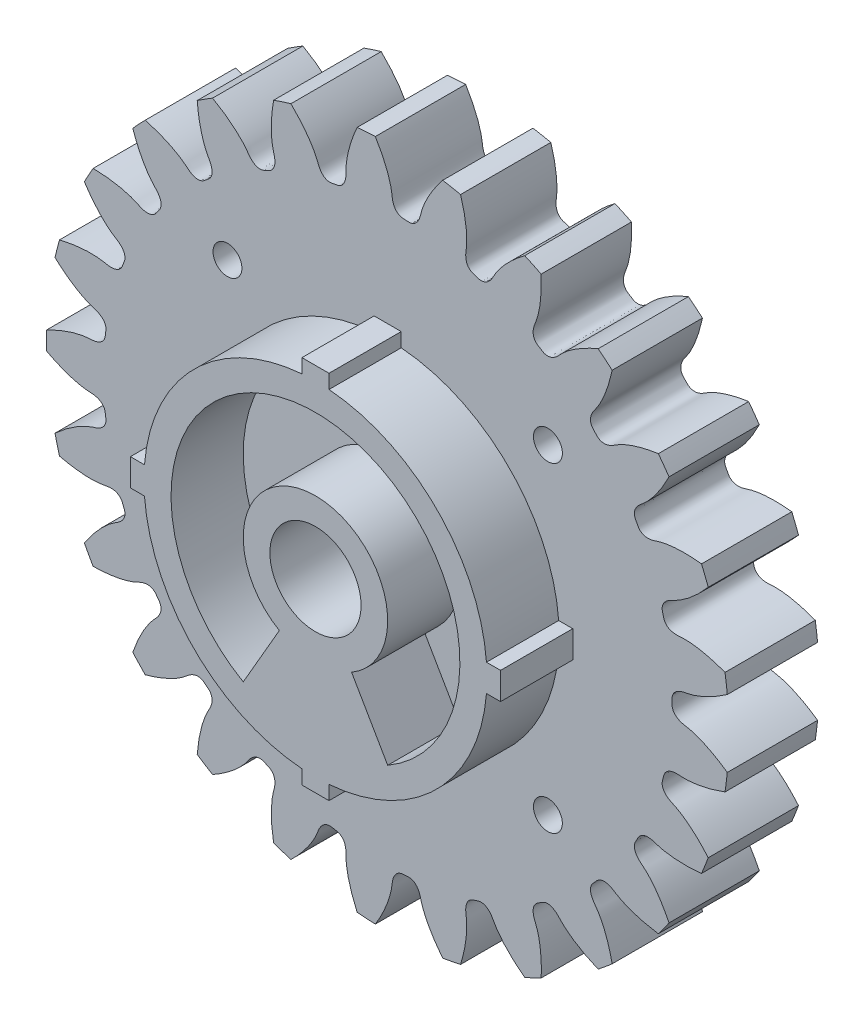
from build123d import *

# Parameters (mm, degrees)
SKETCHREVOLVESPURGEAR_W       = 10
SKETCHREVOLVESPURGEAR_H       = 37.8
TOOTHEXTRUDECUTSPURGEAR_DEPTH = 5
PATTERNSPURGEAR_COUNT         = 25
SKETCH5_R                     = 1.6
CUT_EXTRUDE2_DEPTH            = 10
SKETCH6_R                     = 19
BOSS_EXTRUDE1_DEPTH           = 8
CIRPATTERN3_COUNT             = 4
SKETCH8_W                     = 3
SKETCH8_H                     = 3
BOSS_EXTRUDE2_DEPTH           = 8
CIRPATTERN4_COUNT             = 4
SKETCH9_R                     = 5.05
CUT_EXTRUDE5_DEPTH            = 18
SKETCH10_R                    = 4
CUT_EXTRUDE6_DEPTH            = 7
CIRPATTERN5_COUNT             = 4


with BuildPart() as part:
    # SketchRevolveSpurGear → SpurGear (revolve)
    with BuildSketch(Plane(origin=(0, 0, 0), x_dir=(0, 0, -1), z_dir=(1, 0, 0))):
        with Locations((0, 18.9)):
            Rectangle(SKETCHREVOLVESPURGEAR_W, SKETCHREVOLVESPURGEAR_H)
    revolve(axis=Axis((0, 0, 0), (0, 0, -1)))

    # SketchToothSpurGear → ToothExtrudeCutSpurGear (cut, symmetric)
    with BuildSketch(Plane.XY):
        with BuildLine():
            ThreePointArc((37.746215592, 3.829726949), (37.94, 0), (37.746215592, -3.829726949))
            add(Edge.make_bspline(
                [(37.746215592, -3.829726949), (37.466483699, -3.628766101), (37.04991397, -3.346329775), (36.493998691, -3.004317953), (36.105210331, -2.780261787), (35.734090233, -2.580361385), (35.381686129, -2.403405347), (35.048990413, -2.248142075), (34.73693868, -2.113282503), (34.446408505, -1.997502551), (34.178217902, -1.899444225), (33.933125155, -1.817721903), (33.711824587, -1.750911978), (33.514955545, -1.697595394), (33.34307073, -1.656236267), (33.038212839, -1.592324228), (32.736716629, -1.550959909), (32.449480325, -1.45659371), (32.311613232, -1.402037907), (32.17823805, -1.337513432), (32.04819332, -1.260532473), (31.920714964, -1.166868189), (31.79633739, -1.050531259), (31.678951839, -0.903953297), (31.577973414, -0.720573874), (31.515870655, -0.514514321), (31.490908676, -0.269488785), (31.505461765, 0), (31.490908676, 0.269488785), (31.515870655, 0.514514321), (31.577973414, 0.720573874), (31.678951839, 0.903953297), (31.79633739, 1.050531259), (31.920714964, 1.166868189), (32.04819332, 1.260532473), (32.17823805, 1.337513432), (32.311613232, 1.402037907), (32.449480325, 1.45659371), (32.736716629, 1.550959909), (33.038212839, 1.592324228), (33.34307073, 1.656236267), (33.514955545, 1.697595394), (33.711824587, 1.750911978), (33.933125155, 1.817721903), (34.178217902, 1.899444225), (34.446408505, 1.997502551), (34.73693868, 2.113282503), (35.048990413, 2.248142075), (35.381686129, 2.403405347), (35.734090233, 2.580361385), (36.105210331, 2.780261787), (36.493998691, 3.004317953), (37.04991397, 3.346329775), (37.466483699, 3.628766101), (37.746215592, 3.829726949)],
                knots=[0, 0, 0, 0, 0.066628363, 0.097312478, 0.126243214, 0.153420573, 0.178844554, 0.202515157, 0.224432382, 0.244596229, 0.263006698, 0.279663789, 0.294567502, 0.307717838, 0.319114795, 0.328758375, 0.367985616, 0.377666442, 0.387173495, 0.396651881, 0.406296908, 0.416367886, 0.427194119, 0.439149378, 0.452549791, 0.467442003, 0.480440239, 0.5, 0.519559761, 0.532557997, 0.547450209, 0.560850622, 0.572805881, 0.583632114, 0.593703092, 0.603348119, 0.612826505, 0.622333558, 0.632014384, 0.671241625, 0.680885205, 0.692282162, 0.705432498, 0.720336211, 0.736993302, 0.755403771, 0.775567618, 0.797484843, 0.821155446, 0.846579427, 0.873756786, 0.902687522, 0.933371637, 1, 1, 1, 1], degree=3))
        make_face()
    toothextrudecutspurgear = extrude(amount=TOOTHEXTRUDECUTSPURGEAR_DEPTH, both=True, mode=Mode.SUBTRACT)

    # PatternSpurGear: ToothExtrudeCutSpurGear ×25 about axis
    patternspurgear_axis = Axis((0, 0, 55), (0, 0, -1))
    for i in range(1, PATTERNSPURGEAR_COUNT):
        add(toothextrudecutspurgear.rotate(patternspurgear_axis, i * 360 / PATTERNSPURGEAR_COUNT), mode=Mode.SUBTRACT)

    # Sketch5 → Cut-Extrude2 (cut)
    with BuildSketch(Plane.XY.offset(5)):
        with Locations((17.748380208, 17.748380208)):
            Circle(SKETCH5_R)
    cut_extrude2 = extrude(amount=-CUT_EXTRUDE2_DEPTH, mode=Mode.SUBTRACT)

    # Sketch6 → Boss-Extrude1 (add)
    with BuildSketch(Plane.XY.offset(5)):
        Circle(SKETCH6_R)
        with BuildLine():
            Line((-4, -6.92820323), (-8, -13.856406461))
            ThreePointArc((-8, -13.856406461), (0, 16), (8, -13.856406461))
            Line((8, -13.856406461), (4, -6.92820323))
            ThreePointArc((4, -6.92820323), (0, 8), (-4, -6.92820323))
        make_face(mode=Mode.SUBTRACT)
    extrude(amount=BOSS_EXTRUDE1_DEPTH)

    # CirPattern3: Cut-Extrude2 ×4 about axis
    cirpattern3_axis = Axis((0, 0, 13), (0, 0, -1))
    for i in range(1, CIRPATTERN3_COUNT):
        add(cut_extrude2.rotate(cirpattern3_axis, i * 360 / CIRPATTERN3_COUNT), mode=Mode.SUBTRACT)

    # Sketch8 → Boss-Extrude2 (add)
    with BuildSketch(Plane.XY.offset(5)):
        with Locations((0, 19)):
            Rectangle(SKETCH8_W, SKETCH8_H)
    boss_extrude2 = extrude(amount=BOSS_EXTRUDE2_DEPTH)

    # CirPattern4: Boss-Extrude2 ×4 about axis
    cirpattern4_axis = Axis((0, 0, 13), (0, 0, 1))
    for i in range(1, CIRPATTERN4_COUNT):
        add(boss_extrude2.rotate(cirpattern4_axis, i * 360 / CIRPATTERN4_COUNT))

    # Sketch9 → Cut-Extrude5 (cut)
    with BuildSketch(Plane.XY.offset(13)):
        Circle(SKETCH9_R)
    extrude(amount=-CUT_EXTRUDE5_DEPTH, mode=Mode.SUBTRACT)

    # Sketch10 → Cut-Extrude6 (cut)
    with BuildSketch(Plane(origin=(0, 0, -5), x_dir=(-1, 0, 0), z_dir=(0, 0, -1))):
        with Locations((-17.748380208, 17.748380208)):
            Circle(SKETCH10_R)
    cut_extrude6 = extrude(amount=-CUT_EXTRUDE6_DEPTH, mode=Mode.SUBTRACT)

    # CirPattern5: Cut-Extrude6 ×4 about axis
    cirpattern5_axis = Axis((0, 0, 55), (0, 0, -1))
    for i in range(1, CIRPATTERN5_COUNT):
        add(cut_extrude6.rotate(cirpattern5_axis, i * 360 / CIRPATTERN5_COUNT), mode=Mode.SUBTRACT)


solid = part.part
